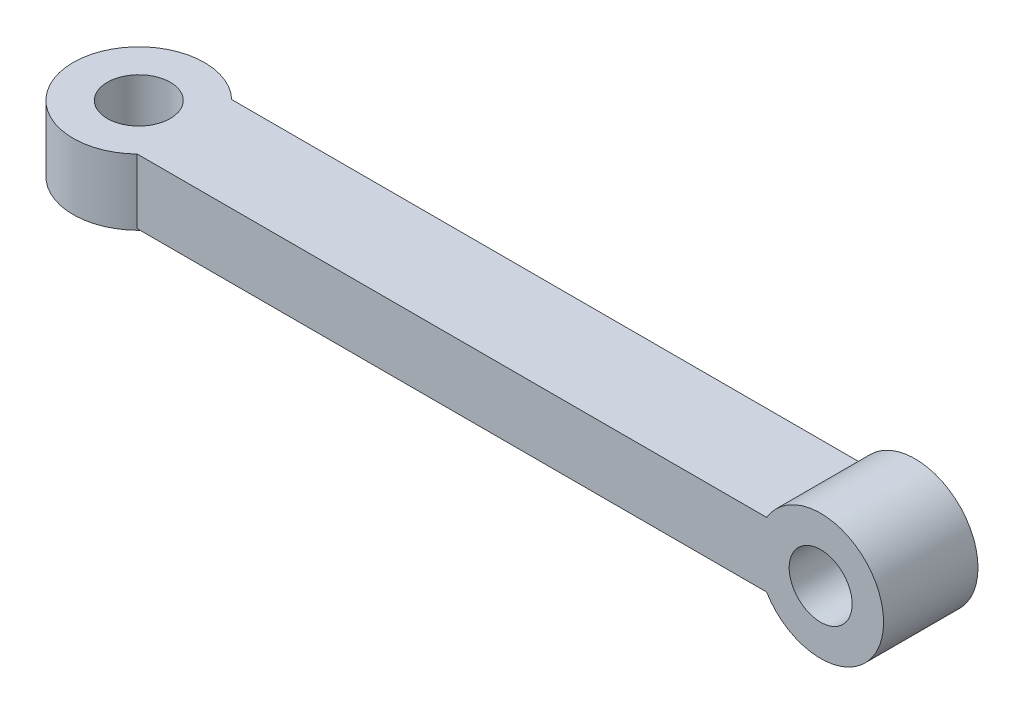
from build123d import *

# Parameters (mm, degrees)
SKETCH4_R           = 5
BOSS_EXTRUDE6_DEPTH = 15
SKETCH9_R           = 10.43494917
SKETCH9_R_2         = 5
BOSS_EXTRUDE8_DEPTH = 10.5


with BuildPart() as part:
    # Sketch4 → Boss-Extrude6 (new body)
    with BuildSketch(Plane.XY):
        with BuildLine():
            Line((101.689180826, -7.145205758), (1.689180826, -7.145205758))
            Line((1.689180826, -7.145205758), (1.689180826, 3.125413503))
            Line((1.689180826, 3.125413503), (101.689180826, 3.125413503))
            ThreePointArc((101.689180826, 3.125413503), (120.269891461, -2.009896128), (101.689180826, -7.145205758))
        make_face()
        with Locations((110.269891461, -2.009896128)):
            Circle(SKETCH4_R, mode=Mode.SUBTRACT)
    extrude(amount=BOSS_EXTRUDE6_DEPTH)

    # Sketch9 → Boss-Extrude8 (add)
    with BuildSketch(Plane(origin=(0, 3.125413503, 0), x_dir=(1, 0, 0), z_dir=(0, 1, 0))):
        with Locations(Location((-5.566035517, -7.5, 0), (0, 0, 180))):
            Circle(SKETCH9_R)
        with Locations(Location((-5.566035517, -7.5, 0), (0, 0, 180))):
            Circle(SKETCH9_R_2, mode=Mode.SUBTRACT)
    extrude(amount=-BOSS_EXTRUDE8_DEPTH)


solid = part.part
